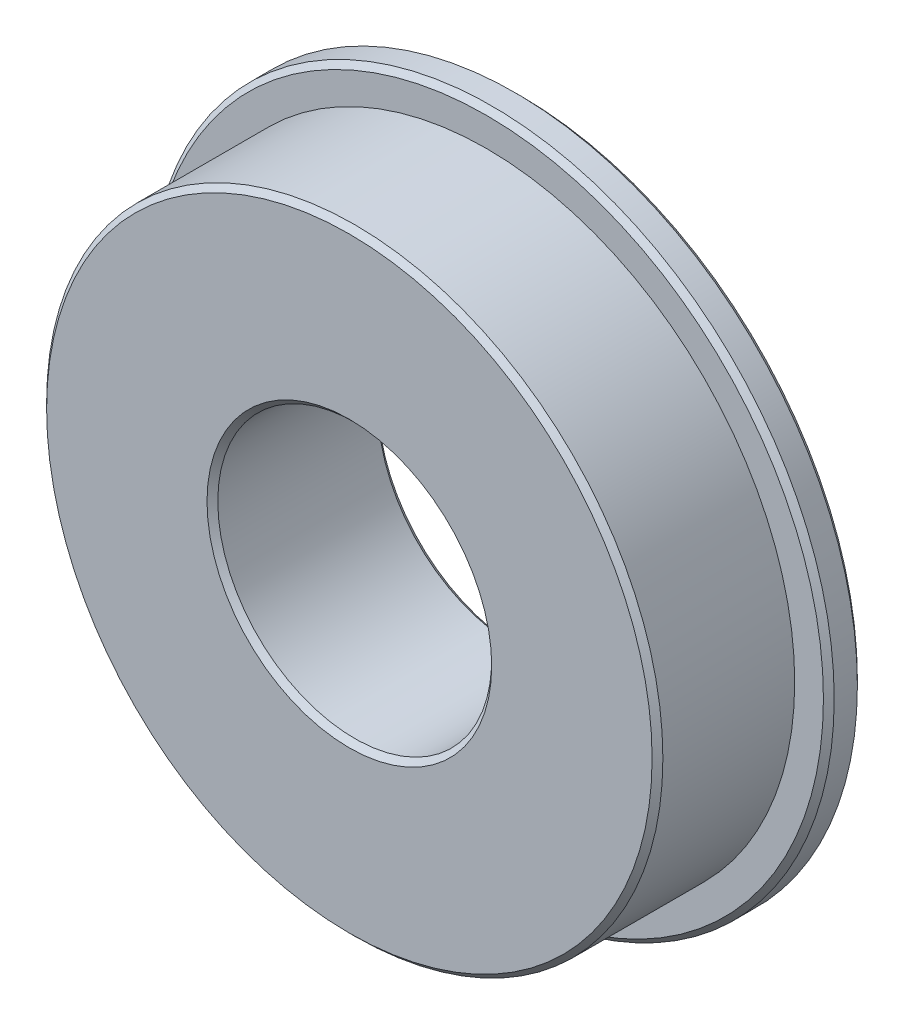
from build123d import *

# Parameters (mm, degrees)
CHAMFER1_SIZE = 0.25


with BuildPart() as part:
    # Sketch1 → Revolve1 (revolve)
    with BuildSketch(Plane(origin=(0, 0, 0), x_dir=(1, 0, 0), z_dir=(0, 1, 0)), mode=Mode.PRIVATE) as revolve1_sk:
        Polygon((-14.287497289, 6.362699291), (-14.287497289, 0), (-6.349997937, 0), (-6.349997937, 7.937499291), (-15.868754486, 7.937499291), (-15.868754486, 6.362699291), align=None)
    revolve(revolve1_sk.sketch.rotate(Axis((0, 0, 0), (0, 0, -1)), 180), axis=Axis((0, 0, 0), (0, 0, -1)))

    # Chamfer1
    chamfer1_edges = [part.edges().sort_by_distance(p)[0] for p in [
        (-14.287497289, 0, 0),
        (-6.349997937, 0, 0),
        (-6.349997937, 0, -7.937499291),
        (-15.868754486, 0, -7.937499291),
        (-15.868754486, 0, -6.362699291),
    ]]
    chamfer(chamfer1_edges, length=CHAMFER1_SIZE)


solid = part.part
